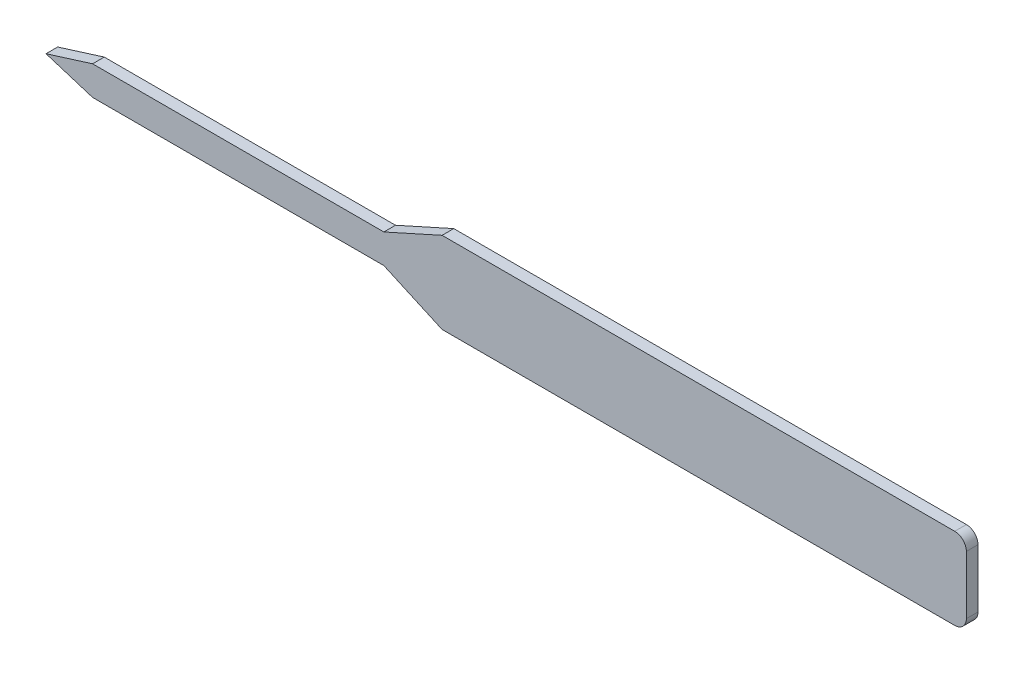
from build123d import *

# Parameters (mm, degrees)
BOSS_EXTRUDE1_DEPTH = 2
FILLET1_R           = 2


with BuildPart() as part:
    # Sketch1 → Boss-Extrude1 (new body)
    with BuildSketch(Plane.XY):
        Polygon((-45, 7), (-55, 2.5), (-105, 2.5), (-113, 0), (-105, -2.5), (-55, -2.5), (-45, -7), (45, -7), (45, 7), align=None)
    extrude(amount=BOSS_EXTRUDE1_DEPTH)

    # Fillet1
    fillet1_edges = [part.edges().sort_by_distance(p)[0] for p in [
        (45, -7, 1),
        (45, 7, 1),
    ]]
    fillet(fillet1_edges, radius=FILLET1_R)


solid = part.part
